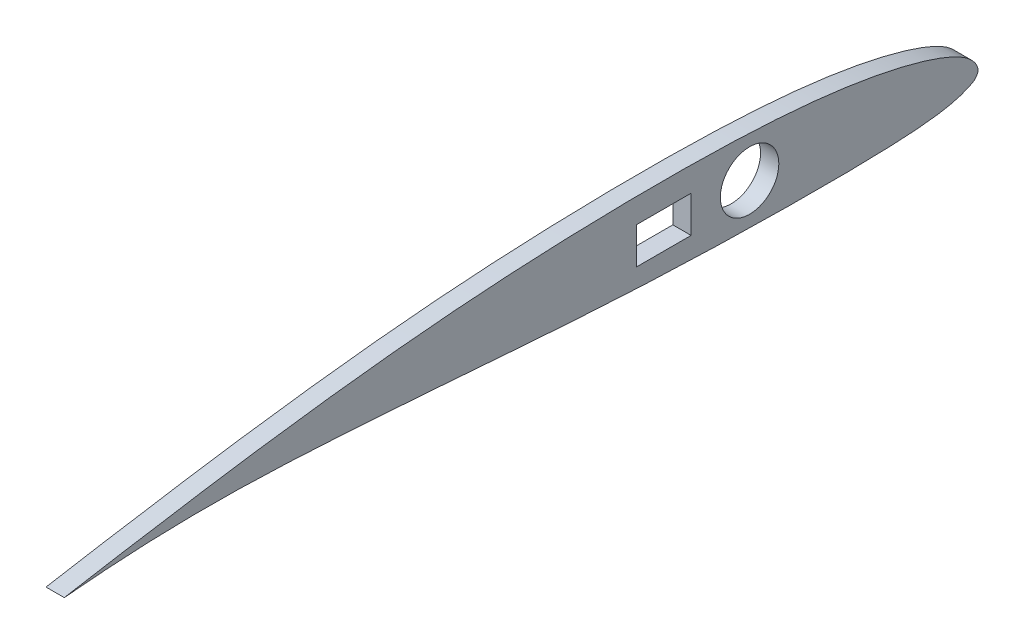
from build123d import *

# Parameters (mm, degrees)
SCHIZZO1_R      = 8
SCHIZZO1_W      = 15
SCHIZZO1_H      = 10
CORPOFOAM_DEPTH = 5


with BuildPart() as part:
    # Schizzo1 → CorpoFoam (new body)
    with BuildSketch(Plane(origin=(0, 0, 0), x_dir=(0, 0, -1), z_dir=(1, 0, 0))):
        with BuildLine():
            add(Edge.make_bspline(
                [(-250, 0), (-250.000228294, -0.008042796), (-248.284955516, 0.172375658), (-246.518112419, 0.308690015), (-242.189387343, 0.685693594), (-236.806461263, 1.074101529), (-229.680385952, 1.49731724), (-221.184158698, 1.823218603), (-211.337618208, 1.967626101), (-200.371188527, 1.833221056), (-188.499913622, 1.38960529), (-175.953687417, 0.706014078), (-162.931424918, -0.160208642), (-149.615771744, -1.148016327), (-136.176354995, -2.19092491), (-122.767140548, -3.219583979), (-109.520053587, -4.152743127), (-96.546095975, -4.938564365), (-83.940819302, -5.536830703), (-71.801839291, -5.947648205), (-60.245256003, -6.218450939), (-49.398732891, -6.355369756), (-39.397226194, -6.381387963), (-30.361934842, -6.26504923), (-22.412181103, -6.012164917), (-15.626227231, -5.597433901), (-10.071907511, -4.928706579), (-5.697692612, -4.040446981), (-2.625320639, -2.865752984), (-0.494884225, -1.71152847), (0.021312549, -0.410454231), (-0.0311692, 0.792659827), (-0.812599242, 2.305684337), (-2.728863517, 4.238352424), (-5.769907241, 6.118172121), (-9.880942804, 7.913594202), (-15.074930468, 9.641318178), (-21.298752222, 11.283896488), (-28.49717212, 12.788381759), (-36.607373406, 14.097834908), (-45.57302844, 15.159429017), (-55.332910074, 15.960903998), (-65.816536498, 16.494069738), (-76.93137626, 16.791989705), (-88.566949028, 16.864754131), (-100.596999886, 16.726715291), (-112.888825982, 16.383385064), (-125.311615819, 15.825573667), (-137.743791097, 15.05233187), (-150.072384382, 14.059339074), (-162.191375056, 12.881586986), (-173.989074322, 11.549280346), (-185.352364446, 10.116249729), (-196.163081698, 8.632379125), (-206.300441402, 7.131513884), (-215.560350587, 5.731221768), (-223.977157043, 4.293295127), (-231.363413336, 3.181808874), (-237.746440904, 2.098942417), (-242.622069366, 1.245861917), (-246.644529332, 0.552864946), (-248.32839844, 0.246216765), (-249.999773563, 0.007977377), (-250, 0)],
                knots=[0, 0, 0, 0, 0.001588889, 0.006329218, 0.014202456, 0.025172808, 0.039173483, 0.056060631, 0.075578924, 0.097363607, 0.120926258, 0.145825281, 0.171670912, 0.198108537, 0.224790184, 0.25139058, 0.277643491, 0.30332675, 0.328257458, 0.352272548, 0.375156062, 0.396620664, 0.416422729, 0.43430442, 0.45005468, 0.463465465, 0.474478994, 0.483169222, 0.489678354, 0.494104066, 0.496910015, 0.497289785, 0.501214273, 0.50645795, 0.513356957, 0.522168632, 0.53296597, 0.545689209, 0.560220779, 0.576438923, 0.594258689, 0.613600245, 0.634342386, 0.656331109, 0.679351894, 0.703152303, 0.727478208, 0.752070739, 0.776691164, 0.801140184, 0.825214387, 0.848697424, 0.871352858, 0.892947449, 0.913230871, 0.931955467, 0.948342069, 0.963693004, 0.976235918, 0.986320059, 0.993788799, 0.998424035, 1, 1, 1, 1], degree=3))
        make_face()
        with Locations((-62.499919709, 5.077322704)):
            Circle(SCHIZZO1_R, mode=Mode.SUBTRACT)
        with Locations((-85.999919709, 5.077322704)):
            Rectangle(SCHIZZO1_W, SCHIZZO1_H, mode=Mode.SUBTRACT)
    extrude(amount=CORPOFOAM_DEPTH)


solid = part.part
